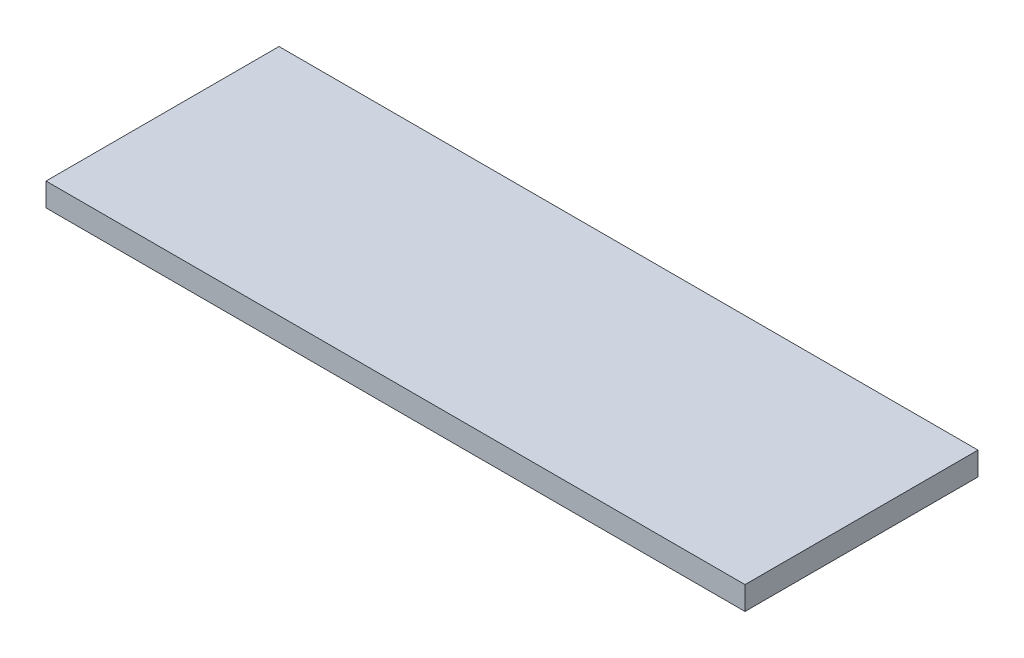
from build123d import *

# Parameters (mm, degrees)
ESBO_O2_W                = 30
ESBO_O2_H                = 10
RESSALTO_EXTRUS_O1_DEPTH = 1


with BuildPart() as part:
    # Esboço2 → Ressalto-extrusão1 (new body)
    with BuildSketch(Plane(origin=(0, 0, 0), x_dir=(1, 0, 0), z_dir=(0, 1, 0))):
        with Locations((15, 5)):
            Rectangle(ESBO_O2_W, ESBO_O2_H)
    extrude(amount=RESSALTO_EXTRUS_O1_DEPTH)


solid = part.part
